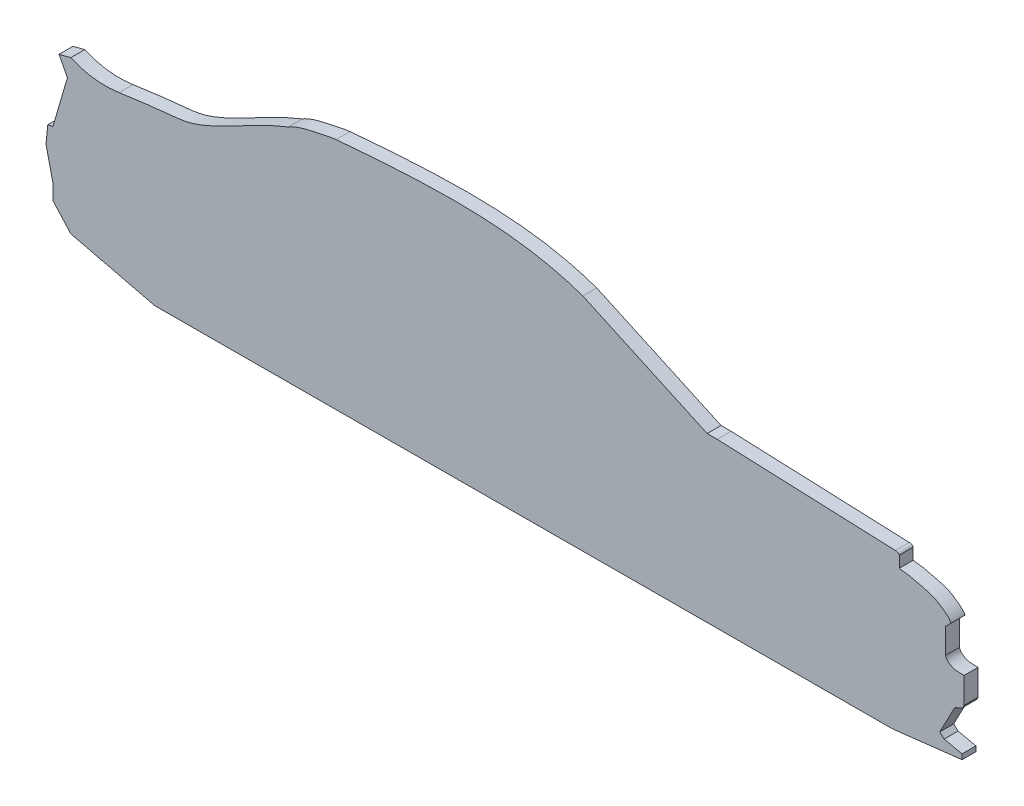
from build123d import *

# Parameters (mm, degrees)
BOSS_EXTRUDE2_DEPTH = 3.18


with BuildPart() as part:
    # Sketch3 → Boss-Extrude2 (new body)
    with BuildSketch(Plane.XY):
        with BuildLine():
            Line((154.566276863, 48.576), (126.154248002, 61.593943228))
            add(Edge.make_bspline(
                [(70.42492341, 64.420190492), (71.539940423, 64.519647115), (74.003845296, 64.716372581), (79.10872622, 65.136602193), (96.644785351, 66.182060474), (113.226942999, 66.103763633), (126.154248002, 61.593943228)],
                knots=[0.037653962, 0.037653962, 0.037653962, 0.037653962, 0.095230039, 0.164778525, 0.301013956, 1, 1, 1, 1], degree=3))
            add(Edge.make_bspline(
                [(69.748246193, 64.358453822), (69.973763165, 64.379520838), (70.199324622, 64.400067666), (70.42492341, 64.420190492)],
                knots=[0.026004729, 0.026004729, 0.026004729, 0.026004729, 0.037653962, 0.037653962, 0.037653962, 0.037653962], degree=3))
            add(Edge.make_bspline(
                [(58.782586434, 61.3879207), (59.955341201, 62.098447326), (61.681198084, 62.675723092), (64.027199959, 63.266819743), (66.422854867, 63.735360745), (68.36941666, 64.202932371), (69.748246193, 64.358453822)],
                knots=[0, 0, 0, 0, 0.338683805, 0.447560599, 0.600475936, 0.944024822, 0.944024822, 0.944024822, 0.944024822], degree=3))
            add(Edge.make_bspline(
                [(20.133826985, 48.853685786), (23.946969175, 49.456022002), (28.845183788, 49.969770281), (34.092791307, 50.505206975), (36.003857037, 50.880366768), (39.598247839, 51.906864384), (47.175860034, 55.732014815), (54.085013367, 59.506177314), (58.782586434, 61.3879207)],
                knots=[0, 0, 0, 0, 0.281454695, 0.359726601, 0.384533669, 0.423485214, 0.632085306, 1, 1, 1, 1], degree=3))
            add(Edge.make_bspline(
                [(9.07850141, 50.252079796), (14.251537818, 47.979183465), (20.133826985, 48.853685786)],
                knots=[0, 0, 0, 1, 1, 1], degree=2))
            Line((9.07850141, 50.252079796), (6.389579219, 49.571823086))
            Line((6.389579219, 49.571823086), (8.304869981, 45.881039625))
            Line((8.304869981, 45.881039625), (5.000125196, 34.613874444))
            Line((5.000125196, 34.613874444), (3.811505877, 34.339527184))
            Line((3.811505877, 34.339527184), (3.408141633, 30.275420379))
            Line((3.408141633, 30.275420379), (5.000125196, 23.378094633))
            Line((5.000125196, 23.378094633), (5.000125196, 19.880575438))
            Line((5.000125196, 19.880575438), (9.07850141, 15.370666667))
            Line((9.07850141, 15.370666667), (28.244198642, 10.740288968))
            Line((28.244198642, 10.740288968), (196.984326141, 11.285656733))
            Line((196.984326141, 11.285656733), (212.842666667, 13.119535563))
            Line((212.842666667, 13.119535563), (212.842666667, 14.278444622))
            Line((212.842666667, 14.278444622), (208.753166993, 15.166653328))
            Line((208.753166993, 15.166653328), (207.756612292, 16.09457661))
            Line((207.756612292, 16.09457661), (211.015778832, 22.30376088))
            add(Edge.make_bspline(
                [(213.311956775, 24.136094227), (213.208583455, 23.862222048), (212.957279088, 23.380062736), (212.30833351, 23.029337441), (211.606742708, 22.860432983), (211.183551066, 22.623391283), (211.015778832, 22.30376088)],
                knots=[0, 0, 0, 0, 0.295149858, 0.505508593, 0.707213933, 1, 1, 1, 1], degree=3))
            Line((213.311956775, 24.136094227), (213.311956775, 30.052431591))
            add(Edge.make_bspline(
                [(209.096417688, 31.906934109), (209.232301931, 31.198493688), (209.920582822, 30.680437528), (211.427560224, 29.98694305), (212.520853083, 30.088762434), (213.311956775, 30.052431591)],
                knots=[0, 0, 0, 0, 0.389815246, 0.499049524, 1, 1, 1, 1], degree=3))
            Line((209.096417688, 31.906934109), (209.096417688, 37.672126537))
            Line((209.096417688, 37.672126537), (210.346467514, 38.922176363))
            add(Edge.make_bspline(
                [(198.487796099, 43.845060743), (200.154143731, 43.736954664), (202.765045449, 43.082987453), (206.182994866, 42.256184747), (208.528724374, 40.831088376), (209.910383176, 39.742707025), (210.346467514, 38.922176363)],
                knots=[0, 0, 0, 0, 0.376788936, 0.61445489, 0.789914739, 1, 1, 1, 1], degree=3))
            Line((198.487796099, 43.845060743), (198.487796099, 46.439819769))
            add(Edge.make_bspline(
                [(197.590488958, 46.929659684), (197.958176787, 46.989526936), (198.336218206, 46.769514411), (198.487796099, 46.439819769)],
                knots=[0, 0, 0, 0, 1, 1, 1, 1], degree=3))
            Line((197.590488958, 46.929659684), (156.874666667, 48.576))
            Line((156.874666667, 48.576), (154.566276863, 48.576))
        make_face()
    extrude(amount=BOSS_EXTRUDE2_DEPTH)


solid = part.part
